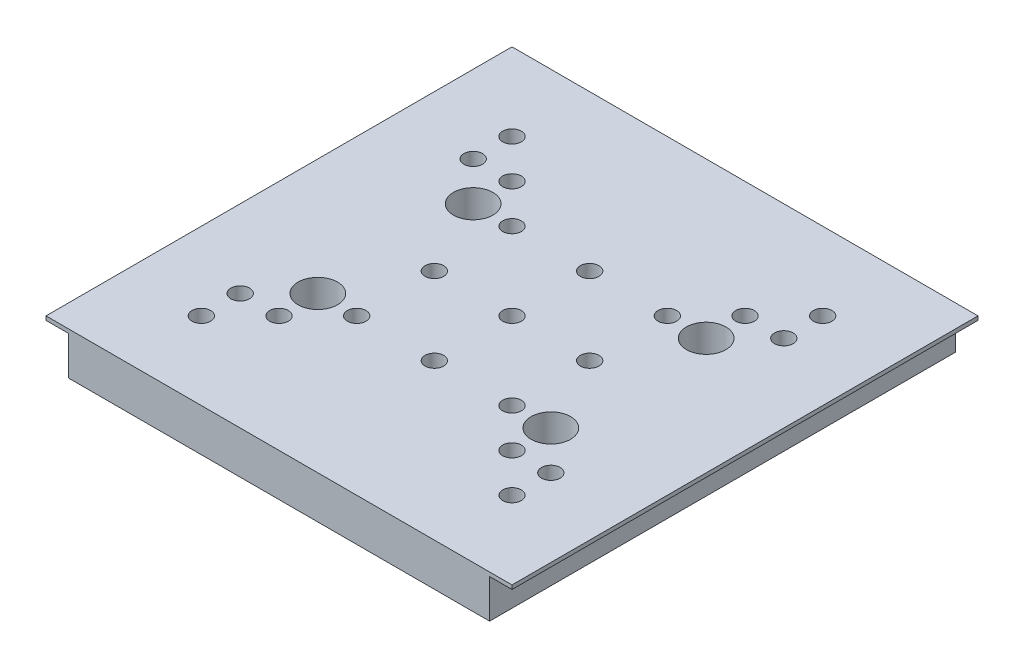
from build123d import *

# Parameters (mm, degrees)
EXTRUDE1_DEPTH                  = 75
F_1_2_0_500000_DIAMETER_HOLE1_D = 12.7
M6X1_0_TAPPED_HOLE1_D           = 6
LPATTERN1_COUNT                 = 2
LPATTERN1_PITCH                 = 25
LPATTERN1_COUNT_DIR2            = 2
LPATTERN1_PITCH_DIR2            = 25
M6X1_0_TAPPED_HOLE2_D           = 6
MIRROR2_COPY_1_D                = 6
MIRROR2_COPY_2_D                = 6
MIRROR2_COPY_3_D                = 6
MIRROR2_COPY_4_D                = 6
MIRROR3_COPY_1_D                = 6
MIRROR3_COPY_2_D                = 6
MIRROR3_COPY_3_D                = 6
MIRROR3_COPY_4_D                = 6
MIRROR3_COPY_5_D                = 6
MIRROR3_COPY_6_D                = 6
MIRROR3_COPY_7_D                = 6
MIRROR3_COPY_8_D                = 6
MIRROR3_COPY_9_D                = 6
MIRROR3_COPY_10_D               = 6


with BuildPart() as part:
    # Sketch1 → Extrude1 (new, symmetric)
    with BuildSketch(Plane.XY):
        Polygon((-67.79, 0), (67.79, 0), (67.79, 12.446), (75, 12.446), (75, 13.716), (-75, 13.716), (-75, 12.446), (-67.79, 12.446), align=None)
    extrude(amount=EXTRUDE1_DEPTH, both=True)

    # 1/2 (0.500000) Diameter Hole1 (through all)
    with Locations(Plane(origin=(0, 13.716, 0), x_dir=(-1, 0, 0), z_dir=(0, 1, 0))):
        with Locations((37.5, 25), (-37.5, 25), (-37.5, -25), (37.5, -25)):
            Hole(F_1_2_0_500000_DIAMETER_HOLE1_D / 2)

    # M6x1.0 Tapped Hole1 (through all)
    with Locations(Plane(origin=(0, 13.716, 0), x_dir=(-1, 0, 0), z_dir=(0, 1, 0))):
        with Locations((0, 0)):
            m6x1_0_tapped_hole1 = Hole(M6X1_0_TAPPED_HOLE1_D / 2)

    # LPattern1: M6x1.0 Tapped Hole1 2 × 2
    with Locations(*[(-i * LPATTERN1_PITCH, 0, -j * LPATTERN1_PITCH_DIR2) for i in range(LPATTERN1_COUNT) for j in range(LPATTERN1_COUNT_DIR2) if (i, j) != (0, 0)]):
        add(m6x1_0_tapped_hole1, mode=Mode.SUBTRACT)

    # M6x1.0 Tapped Hole2 (through all)
    with Locations(Plane(origin=(0, 13.716, 0), x_dir=(-1, 0, 0), z_dir=(0, 1, 0))):
        with Locations((37.5, -37.5), (50, -37.5), (50, -50)):
            m6x1_0_tapped_hole2 = Hole(M6X1_0_TAPPED_HOLE2_D / 2)

    # Mirror2: M6x1.0 Tapped Hole2 across plane
    add(m6x1_0_tapped_hole2.mirror(Plane.XY), mode=Mode.SUBTRACT)

    # Mirror2 copy 1 (through all)
    with Locations(Plane(origin=(0, 13.716, 25), x_dir=(-1, 0, 0), z_dir=(0, 1, 0))):
        with Locations((0, 0)):
            Hole(MIRROR2_COPY_1_D / 2)

    # Mirror2 copy 2 (through all)
    with Locations(Plane(origin=(-25, 13.716, 0), x_dir=(-1, 0, 0), z_dir=(0, 1, 0))):
        with Locations((0, 0)):
            Hole(MIRROR2_COPY_2_D / 2)

    # Mirror2 copy 3 (through all)
    with Locations(Plane(origin=(-25, 13.716, 25), x_dir=(-1, 0, 0), z_dir=(0, 1, 0))):
        with Locations((0, 0)):
            Hole(MIRROR2_COPY_3_D / 2)

    # Mirror2 copy 4 (through all)
    with Locations(Plane(origin=(0, 13.716, 0), x_dir=(-1, 0, 0), z_dir=(0, 1, 0))):
        with Locations((0, 0)):
            Hole(MIRROR2_COPY_4_D / 2)

    # Mirror3: M6x1.0 Tapped Hole2 across plane
    add(m6x1_0_tapped_hole2.mirror(Plane(origin=(0, 0, 0), x_dir=(0, 0, 1), z_dir=(1, 0, 0))), mode=Mode.SUBTRACT)

    # Mirror3 copy 1 (through all)
    with Locations(Plane(origin=(0, 13.716, -25), x_dir=(1, 0, 0), z_dir=(0, 1, 0))):
        with Locations((0, 0)):
            Hole(MIRROR3_COPY_1_D / 2)

    # Mirror3 copy 2 (through all)
    with Locations(Plane(origin=(25, 13.716, 0), x_dir=(1, 0, 0), z_dir=(0, 1, 0))):
        with Locations((0, 0)):
            Hole(MIRROR3_COPY_2_D / 2)

    # Mirror3 copy 3 (through all)
    with Locations(Plane(origin=(25, 13.716, -25), x_dir=(1, 0, 0), z_dir=(0, 1, 0))):
        with Locations((0, 0)):
            Hole(MIRROR3_COPY_3_D / 2)

    # Mirror3 copy 4 (through all)
    with Locations(Plane(origin=(0, 13.716, 0), x_dir=(1, 0, 0), z_dir=(0, 1, 0))):
        with Locations((0, 0)):
            Hole(MIRROR3_COPY_4_D / 2)

    # Mirror3 copy 5 (through all)
    with Locations(Plane(origin=(0, 13.716, 0), x_dir=(1, 0, 0), z_dir=(0, 1, 0))):
        with Locations((37.5, -37.5), (50, -37.5), (50, -50)):
            Hole(MIRROR3_COPY_5_D / 2)

    # Mirror3 copy 6 (through all)
    with Locations(Plane(origin=(0, 13.716, 25), x_dir=(1, 0, 0), z_dir=(0, 1, 0))):
        with Locations((0, 0)):
            Hole(MIRROR3_COPY_6_D / 2)

    # Mirror3 copy 7 (through all)
    with Locations(Plane(origin=(25, 13.716, 0), x_dir=(1, 0, 0), z_dir=(0, 1, 0))):
        with Locations((0, 0)):
            Hole(MIRROR3_COPY_7_D / 2)

    # Mirror3 copy 8 (through all)
    with Locations(Plane(origin=(25, 13.716, 25), x_dir=(1, 0, 0), z_dir=(0, 1, 0))):
        with Locations((0, 0)):
            Hole(MIRROR3_COPY_8_D / 2)

    # Mirror3 copy 9 (through all)
    with Locations(Plane(origin=(0, 13.716, 0), x_dir=(1, 0, 0), z_dir=(0, 1, 0))):
        with Locations((0, 0)):
            Hole(MIRROR3_COPY_9_D / 2)

    # Mirror3 copy 10 (through all)
    with Locations(Plane(origin=(0, 13.716, 0), x_dir=(1, 0, 0), z_dir=(0, 1, 0))):
        with Locations((0, 0)):
            Hole(MIRROR3_COPY_10_D / 2)


solid = part.part
